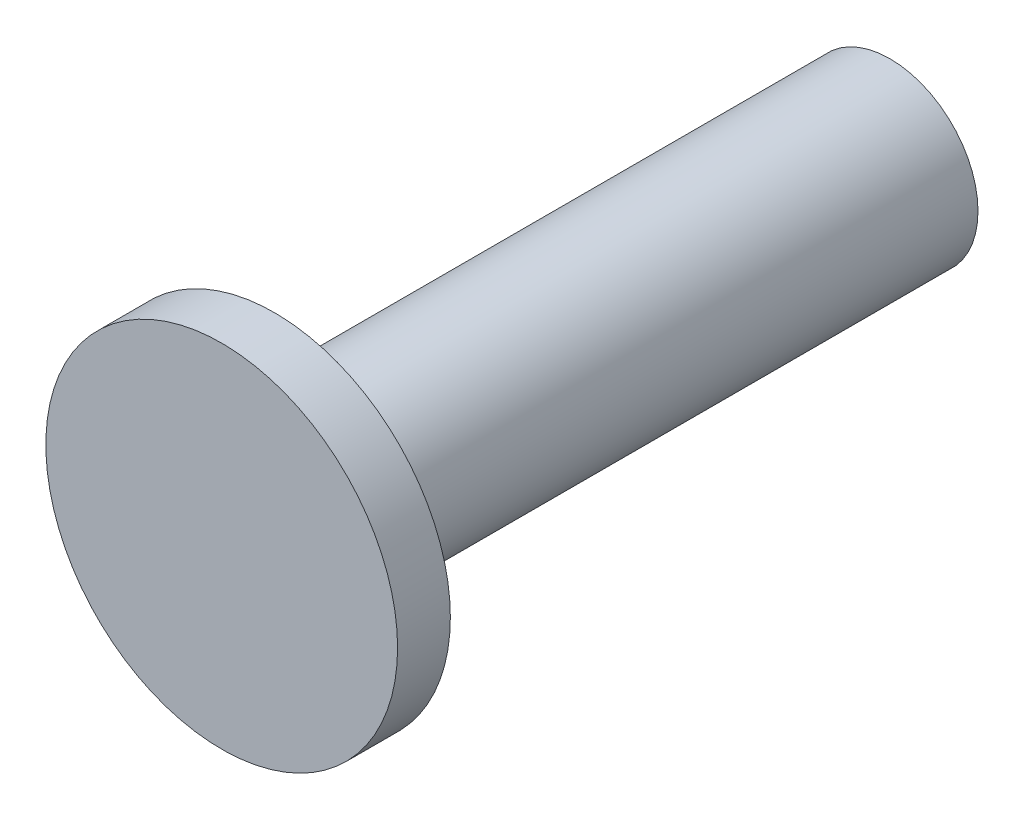
from build123d import *

# Parameters (mm, degrees)
ESQUISSE1_R        = 5
BOSS_EXTRU_1_DEPTH = 35
ESQUISSE3_R        = 10
BOSS_EXTRU_2_DEPTH = 3
CONG_1_R           = 0.5


with BuildPart() as part:
    # Esquisse1 → Boss.-Extru.1 (new body)
    with BuildSketch(Plane.XY):
        Circle(ESQUISSE1_R)
    extrude(amount=BOSS_EXTRU_1_DEPTH)

    # Esquisse3 → Boss.-Extru.2 (add)
    with BuildSketch(Plane.XY.offset(35)):
        Circle(ESQUISSE3_R)
    extrude(amount=BOSS_EXTRU_2_DEPTH)

    # Congé1
    cong_1_edges = [part.edges().sort_by_distance(p)[0] for p in [
        (-5, 0, 35),
    ]]
    fillet(cong_1_edges, radius=CONG_1_R)


solid = part.part
